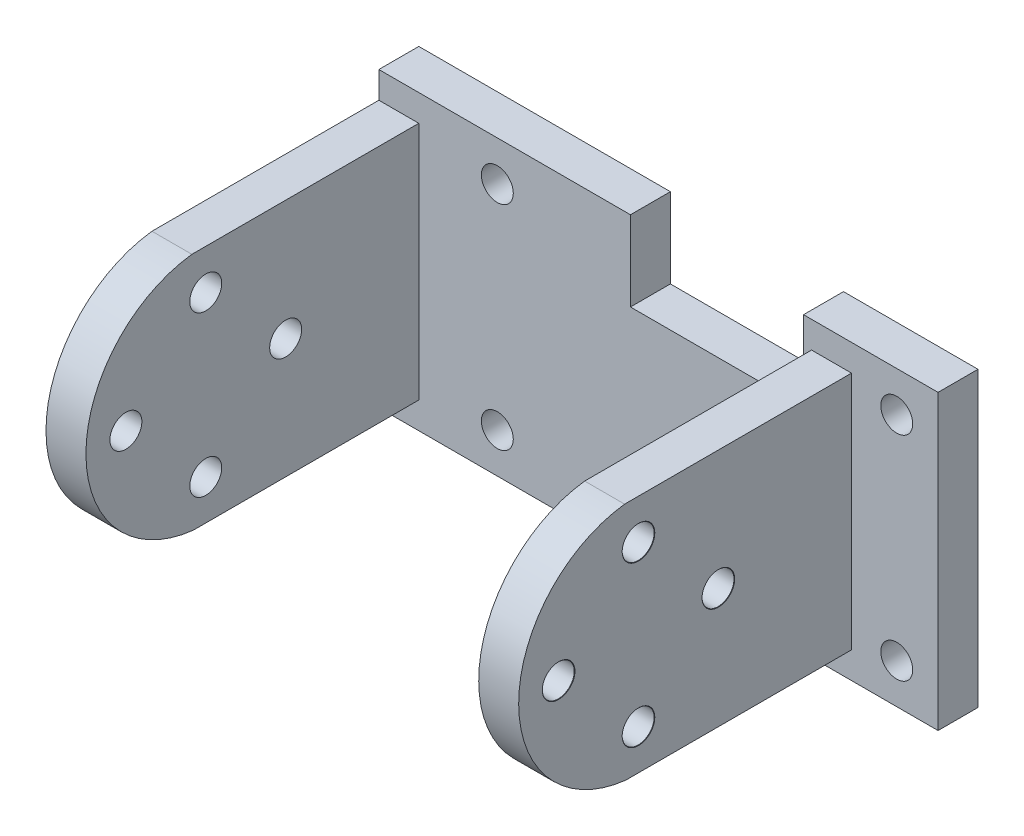
from build123d import *

# Parameters (mm, degrees)
SKETCH1_W                      = 42
SKETCH1_H                      = 22
BOSS_EXTRUDE1_DEPTH            = 3
SKETCH2_W                      = 13
SKETCH2_H                      = 6
CUT_EXTRUDE1_DEPTH             = 236.13156647
SKETCH3_W                      = 13
SKETCH3_H                      = 6
CUT_EXTRUDE2_DEPTH             = 236.13156647
BOSS_EXTRUDE2_DEPTH            = 3
BOSS_EXTRUDE3_START            = -3
BOSS_EXTRUDE3_DEPTH            = 3
M2_CLEARANCE_HOLE1_D           = 2.4
M2_CLEARANCE_HOLE1_CSINK_D     = 2.45
M2_CLEARANCE_HOLE1_CSINK_ANGLE = 90
M2_CLEARANCE_HOLE2_D           = 2.4


with BuildPart() as part:
    # Sketch1 → Boss-Extrude1 (new body)
    with BuildSketch(Plane.XY.offset(47.892560215)):
        with Locations((8.75, 222.222621224)):
            Rectangle(SKETCH1_W, SKETCH1_H)
    extrude(amount=-BOSS_EXTRUDE1_DEPTH)

    # Sketch2 → Cut-Extrude1 (cut, through all)
    with BuildSketch(Plane(origin=(0, 0, 44.892560215), x_dir=(-1, 0, 0), z_dir=(0, 0, -1))):
        with Locations((-13.146676675, 230.222621224)):
            Rectangle(SKETCH2_W, SKETCH2_H)
    extrude(amount=-CUT_EXTRUDE1_DEPTH, mode=Mode.SUBTRACT)

    # Sketch3 → Cut-Extrude2 (cut, through all)
    with BuildSketch(Plane(origin=(0, 0, 44.892560215), x_dir=(-1, 0, 0), z_dir=(0, 0, -1))):
        with Locations((-13.146676675, 214.222621224)):
            Rectangle(SKETCH3_W, SKETCH3_H)
    extrude(amount=-CUT_EXTRUDE2_DEPTH, mode=Mode.SUBTRACT)

    # Sketch4 → Boss-Extrude2 (add)
    with BuildSketch(Plane(origin=(-12.25, 0, 0), x_dir=(0, -1, 0), z_dir=(-1, 0, 0))):
        with BuildLine():
            Line((-231.222621224, 64.935707597), (-231.222621224, 47.892560215))
            Line((-231.222621224, 47.892560215), (-213.222621224, 47.892560215))
            Line((-213.222621224, 47.892560215), (-213.222621224, 64.839486293))
            ThreePointArc((-213.222621224, 64.839486293), (-222.179830351, 72.892432503), (-231.222621224, 64.935707597))
        make_face()
    extrude(amount=-BOSS_EXTRUDE2_DEPTH)

    # Sketch5 → Boss-Extrude3 (add)
    with BuildSketch(Plane(origin=(23.25, 0, 0), x_dir=(0, 0, -1), z_dir=(1, 0, 0)).offset(BOSS_EXTRUDE3_START)):
        with BuildLine():
            Line((-64.839486293, 213.222621224), (-47.892560215, 213.222621224))
            Line((-47.892560215, 213.222621224), (-47.892560215, 231.222621224))
            Line((-47.892560215, 231.222621224), (-64.935707597, 231.222621224))
            ThreePointArc((-64.935707597, 231.222621224), (-72.892432503, 222.179830351), (-64.839486293, 213.222621224))
        make_face()
    extrude(amount=BOSS_EXTRUDE3_DEPTH)

    # M2 Clearance Hole1 (through all)
    with Locations(Plane(origin=(23.25, 0, 0), x_dir=(0, 0, -1), z_dir=(1, 0, 0))):
        with Locations((-63.892759177, 228.222223301), (-69.892560215, 222.222422263), (-63.892759177, 216.222621224), (-57.892958138, 222.222422263)):
            CounterSinkHole(M2_CLEARANCE_HOLE1_D / 2, M2_CLEARANCE_HOLE1_CSINK_D / 2, counter_sink_angle=M2_CLEARANCE_HOLE1_CSINK_ANGLE)

    # M2 Clearance Hole2 (through all)
    with Locations(Plane.XY.offset(47.892560215)):
        with Locations((-3.353323325, 230.214980721), (-3.353323325, 214.214980721), (26.646676675, 214.214980721), (26.646676675, 230.214980721)):
            Hole(M2_CLEARANCE_HOLE2_D / 2)


solid = part.part
